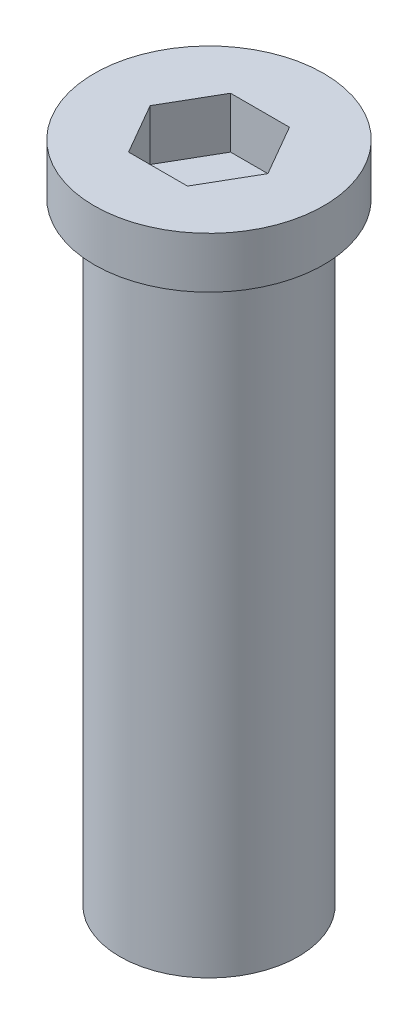
from build123d import *

# Parameters (mm, degrees)
SKETCH1_R           = 1.75
BOSS_EXTRUDE1_DEPTH = 6
SKETCH2_R           = 2.25
BOSS_EXTRUDE2_DEPTH = 1
CUT_EXTRUDE1_DEPTH  = 1


with BuildPart() as part:
    # Sketch1 → Boss-Extrude1 (new, symmetric)
    with BuildSketch(Plane(origin=(0, 0, 0), x_dir=(1, 0, 0), z_dir=(0, 1, 0))):
        with Locations(Location((0, 0, 0), (0, 0, 270))):
            Circle(SKETCH1_R)
    extrude(amount=BOSS_EXTRUDE1_DEPTH, both=True)

    # Sketch2 → Boss-Extrude2 (add)
    with BuildSketch(Plane(origin=(0, 6, 0), x_dir=(1, 0, 0), z_dir=(0, 1, 0))):
        with Locations(Location((0, 0, 0), (0, 0, 270))):
            Circle(SKETCH2_R)
    extrude(amount=BOSS_EXTRUDE2_DEPTH)

    # Sketch3 → Cut-Extrude1 (cut)
    with BuildSketch(Plane(origin=(0, 7, 0), x_dir=(1, 0, 0), z_dir=(0, 1, 0))):
        Polygon((0.577350272, 1), (1.154700538, -4e-09), (0.577350269, -1.000000006), (-0.577350271, -1.000000002), (-1.15470054, 0), (-0.577350268, 1), align=None)
    extrude(amount=-CUT_EXTRUDE1_DEPTH, mode=Mode.SUBTRACT)


solid = part.part
